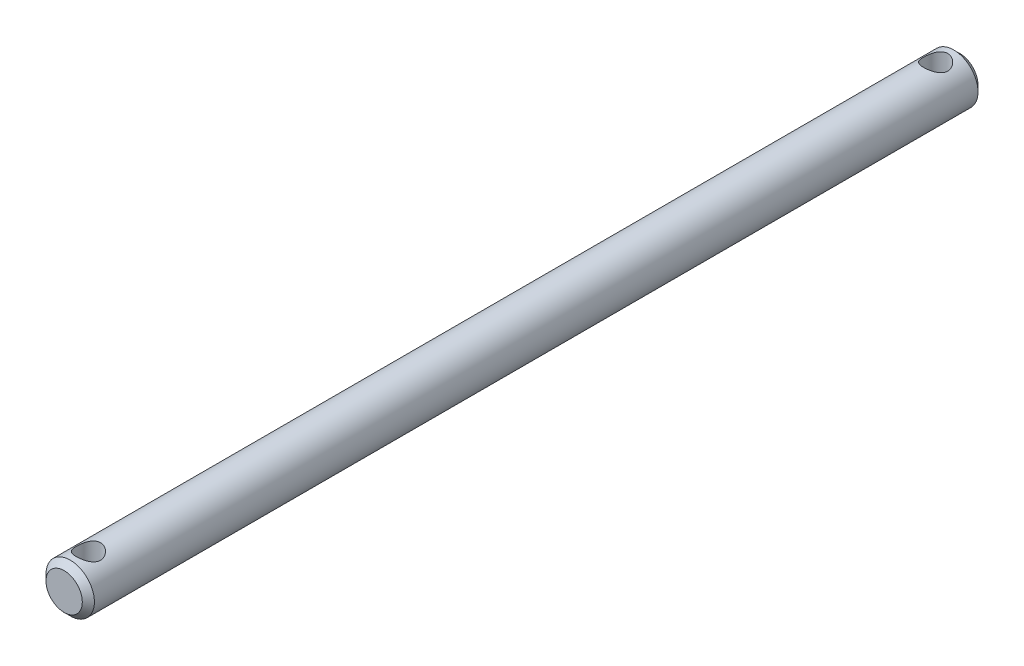
from build123d import *

# Parameters (mm, degrees)
SKETCH_1_R               = 2
EXTRUDE_1_DEPTH          = 74
CHAMFER_1_SIZE           = 0.5
CUT_EXTRUDE_1_DEPTH      = 75.054034326
CUT_EXTRUDE_1_DEPTH_BACK = 75.054034326
SKETCH_2_R               = 1


with BuildPart() as part:
    # 草圖1 → 填料-伸長1 (new body)
    with BuildSketch(Plane.XY):
        Circle(SKETCH_1_R)
    extrude(amount=EXTRUDE_1_DEPTH)

    # 導角1
    chamfer_1_edges = [part.edges().sort_by_distance(p)[0] for p in [
        (-2, 0, 0),
        (-2, 0, 74),
    ]]
    chamfer(chamfer_1_edges, length=CHAMFER_1_SIZE)

    # 草圖2 → 除料-伸長1 (cut, two sides: drawn at the far end of the back side and taken through both)
    with BuildSketch(Plane(origin=(0, 0, 0), x_dir=(1, 0, 0), z_dir=(0, 1, 0)).offset(-CUT_EXTRUDE_1_DEPTH_BACK)):
        with Locations(Location((0, -2, 0), (0, 0, 270))):
            Circle(SKETCH_2_R)
        with Locations(Location((0, -72, 0), (0, 0, 270))):
            Circle(SKETCH_2_R)
    extrude(amount=CUT_EXTRUDE_1_DEPTH + CUT_EXTRUDE_1_DEPTH_BACK, mode=Mode.SUBTRACT)


solid = part.part
